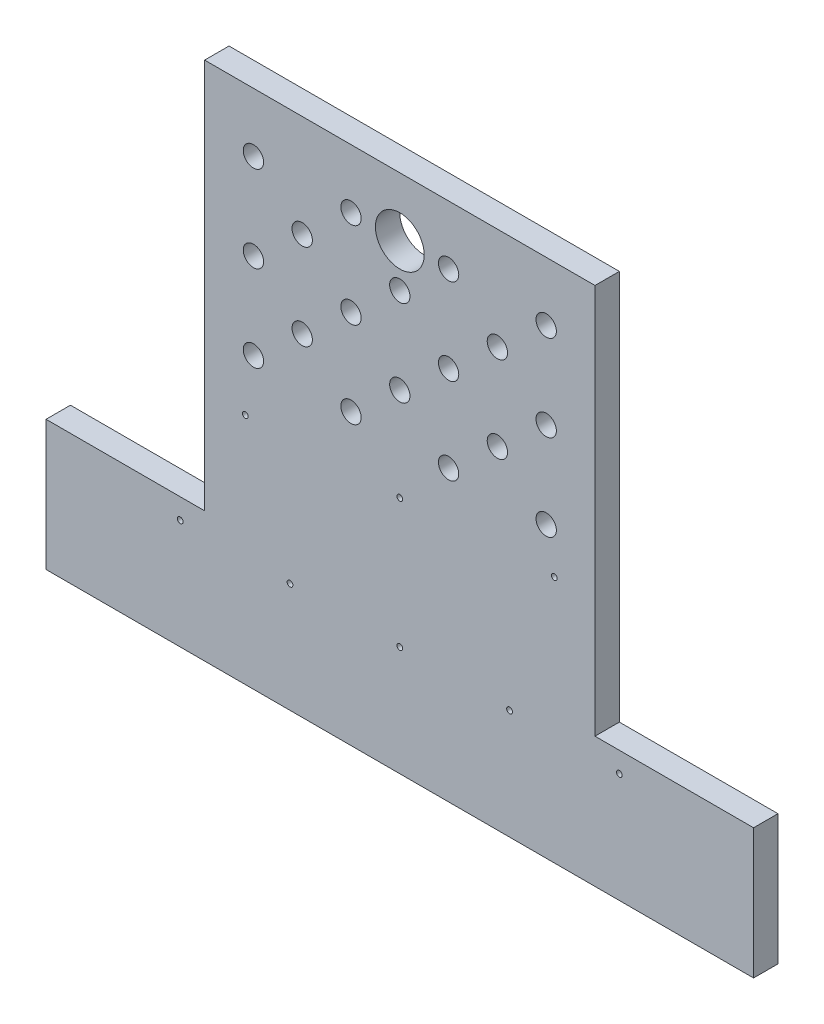
from build123d import *

# Parameters (mm, degrees)
BOSS_EXTRUDE1_DEPTH                            = 19.05
SKETCH2_R                                      = 7.9375
CUT_EXTRUDE1_DEPTH                             = 451.68227514
CSK_FOR_8_FLAT_HEAD_MACHINE_SCREW1_D           = 4.4958
CSK_FOR_8_FLAT_HEAD_MACHINE_SCREW1_CSINK_D     = 8.4328
CSK_FOR_8_FLAT_HEAD_MACHINE_SCREW1_CSINK_ANGLE = 82
HOLE1_D                                        = 38.1
F_5_64_0_07813_DIAMETER_HOLE1_D                = 1.984502
F_5_64_0_07813_DIAMETER_HOLE1_DEPTH            = 11.1252
F_5_64_0_07813_DIAMETER_HOLE1_TIP              = 0.59620455


with BuildPart() as part:
    # Sketch1 → Boss-Extrude1 (new body)
    with BuildSketch(Plane.XY):
        Polygon((-152.4, 50.8), (-152.4, 355.6), (152.4, 355.6), (152.4, 50.8), (276.225, 50.8), (276.225, -50.8), (-276.225, -50.8), (-276.225, 50.8), align=None)
    extrude(amount=BOSS_EXTRUDE1_DEPTH)

    # Sketch2 → Cut-Extrude1 (cut, through all)
    with BuildSketch(Plane.XY.offset(19.05)):
        with Locations((-114.3, 309.5625)):
            Circle(SKETCH2_R)
        with Locations((-38.1, 309.5625)):
            Circle(SKETCH2_R)
        with Locations((38.1, 309.5625)):
            Circle(SKETCH2_R)
        with Locations((114.3, 309.5625)):
            Circle(SKETCH2_R)
        with Locations((-76.2, 275.9075)):
            Circle(SKETCH2_R)
        with Locations((0, 275.9075)):
            Circle(SKETCH2_R)
        with Locations((76.2, 275.9075)):
            Circle(SKETCH2_R)
        with Locations((-114.3, 242.2525)):
            Circle(SKETCH2_R)
        with Locations((-38.1, 242.2525)):
            Circle(SKETCH2_R)
        with Locations((38.1, 242.2525)):
            Circle(SKETCH2_R)
        with Locations((114.3, 242.2525)):
            Circle(SKETCH2_R)
        with Locations((76.2, 208.5975)):
            Circle(SKETCH2_R)
        with Locations((0, 208.5975)):
            Circle(SKETCH2_R)
        with Locations((-76.2, 208.5975)):
            Circle(SKETCH2_R)
        with Locations((-114.3, 174.9425)):
            Circle(SKETCH2_R)
        with Locations((-38.1, 174.9425)):
            Circle(SKETCH2_R)
        with Locations((38.1, 174.9425)):
            Circle(SKETCH2_R)
        with Locations((114.3, 174.9425)):
            Circle(SKETCH2_R)
    extrude(amount=-CUT_EXTRUDE1_DEPTH, mode=Mode.SUBTRACT)

    # CSK for #8 Flat Head Machine Screw1 (through all)
    with Locations(Plane(origin=(0, 0, 0), x_dir=(-1, 0, 0), z_dir=(0, 0, -1))):
        with Locations((-171.45, 34.925), (-85.725, 34.925), (0, 34.925), (171.45, 34.925), (85.725, 34.925), (-120.65, 142.579301206), (0, 135.791261042), (120.65, 131.466801206)):
            CounterSinkHole(CSK_FOR_8_FLAT_HEAD_MACHINE_SCREW1_D / 2, CSK_FOR_8_FLAT_HEAD_MACHINE_SCREW1_CSINK_D / 2, counter_sink_angle=CSK_FOR_8_FLAT_HEAD_MACHINE_SCREW1_CSINK_ANGLE)

    # Hole1 (through all)
    with Locations(Plane.XY.offset(19.05)):
        with Locations((0, 309.5625)):
            Hole(HOLE1_D / 2)

    # 5/64 (0.07813) Diameter Hole1
    with Locations(Plane(origin=(0, 0, 0), x_dir=(-1, 0, 0), z_dir=(0, 0, -1))):
        with Locations((-26.305822693, 290.03907182), (-26.307719853, 258.289071876), (26.30582273, 258.285928054), (26.307719891, 290.035927997)):
            Hole(F_5_64_0_07813_DIAMETER_HOLE1_D / 2, depth=F_5_64_0_07813_DIAMETER_HOLE1_DEPTH)
            with Locations((0, 0, -(F_5_64_0_07813_DIAMETER_HOLE1_DEPTH + F_5_64_0_07813_DIAMETER_HOLE1_TIP / 2))):  # 118° drill point
                Cone(0, F_5_64_0_07813_DIAMETER_HOLE1_D / 2, F_5_64_0_07813_DIAMETER_HOLE1_TIP, mode=Mode.SUBTRACT)


solid = part.part
